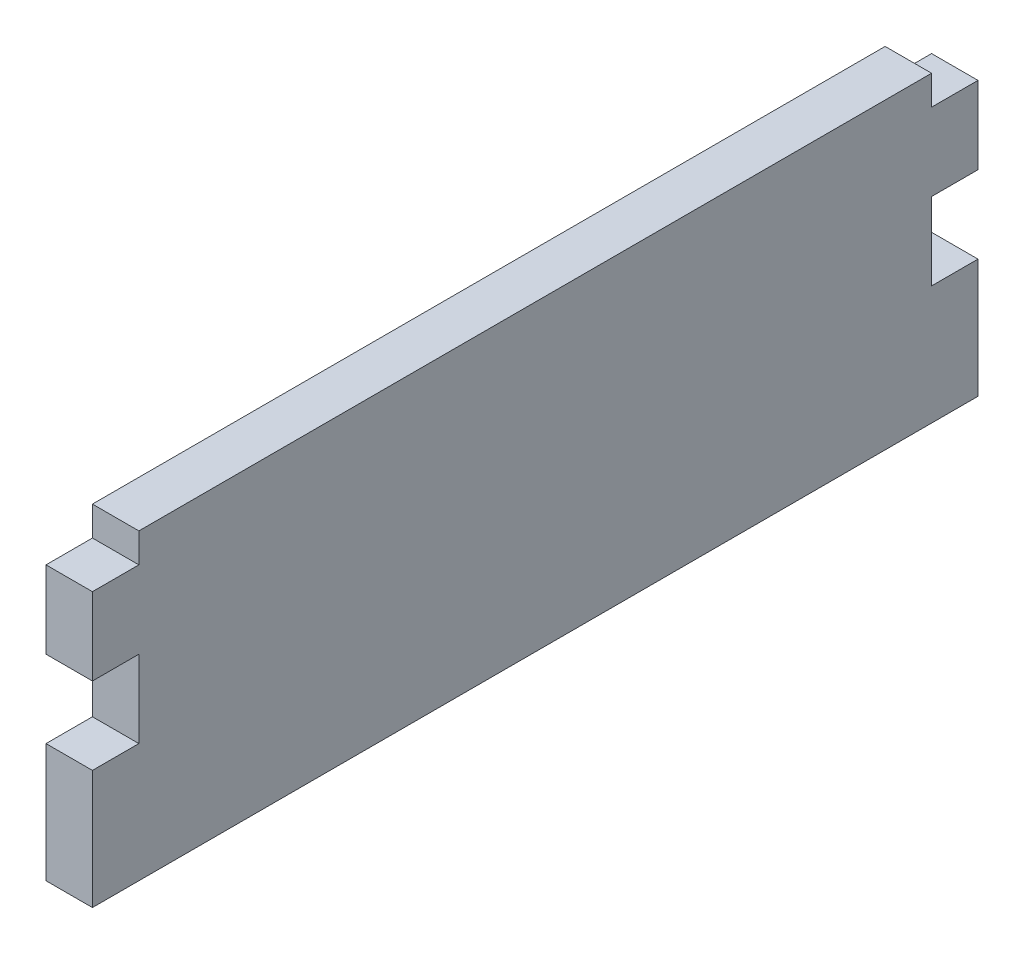
from build123d import *

# Parameters (mm, degrees)
EXTRUDE_1_DEPTH = 6


with BuildPart() as part:
    # Эскиз1 → Бобышка-Вытянуть1 (new body)
    with BuildSketch(Plane(origin=(0, 0, 0), x_dir=(0, 0, -1), z_dir=(1, 0, 0))):
        Polygon((3.017456638, -135.730110247), (3.017456638, -136.745366564), (-111.412543362, -136.745366564), (-111.412543362, -135.730110247), (-111.412543362, -121.39155652), (-105.412543362, -121.39155652), (-105.412543362, -111.39155652), (-111.412543362, -111.39155652), (-111.412543362, -101.39155652), (-105.412543362, -101.39155652), (-105.412543362, -97.59155652), (-2.982543362, -97.59155652), (-2.982543362, -101.39155652), (3.017456638, -101.39155652), (3.017456638, -111.39155652), (-2.982543362, -111.39155652), (-2.982543362, -121.39155652), (3.017456638, -121.39155652), align=None)
    extrude(amount=EXTRUDE_1_DEPTH)


solid = part.part
